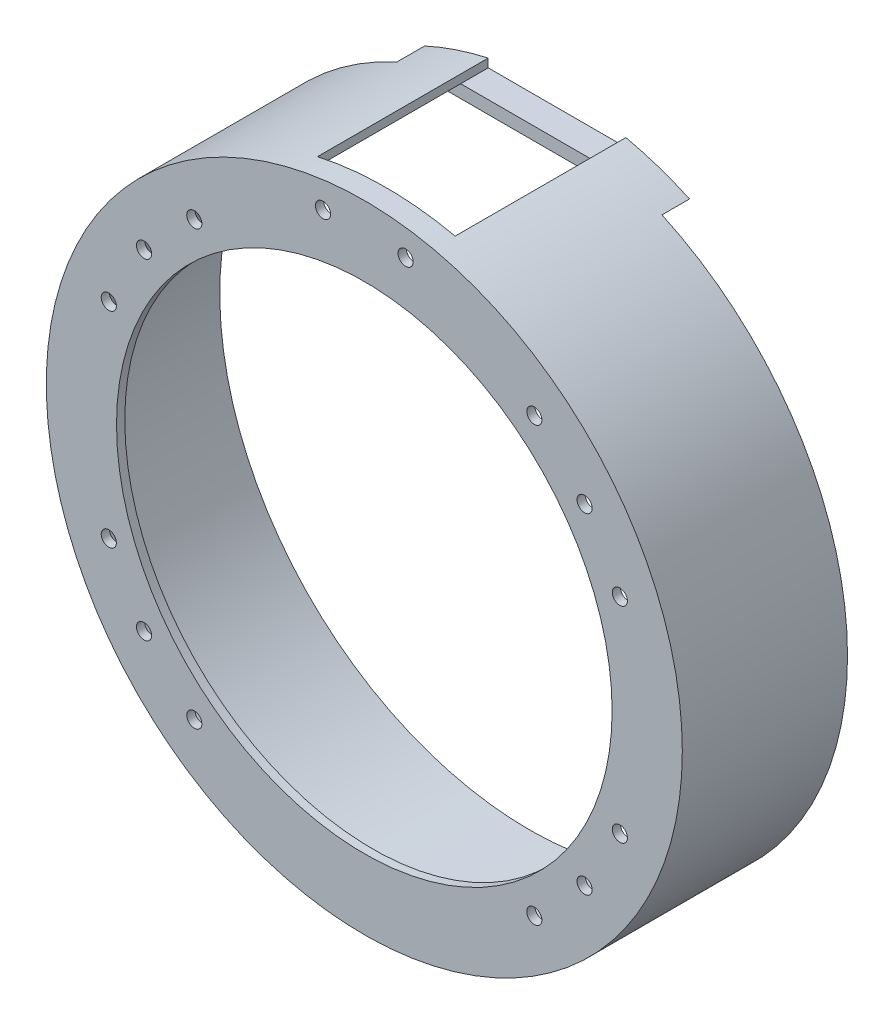
from build123d import *
from build123d.topology import SkipClean

# Parameters (mm, degrees)
SKETCH_1_R           = 112.5
SKETCH_1_R_2         = 90
EXTRUDE_1_DEPTH      = 3
EXTRUDE_START        = -60
EXTRUDE_2_DEPTH      = 60
SKETCH_5_R           = 2.75
CUT_EXTRUDE_1_DEPTH  = 10
EXTRUDE_3_DEPTH      = 5
EXTRUDE_3_DEPTH_BACK = 3
SKETCH_6_R           = 115.5
SKETCH_6_R_2         = 112.5
EXTRUDE_START_2      = 10
EXTRUDE_4_DEPTH      = 10


with BuildPart() as part:
    # 草图1 → 凸台-拉伸1 (new body)
    with BuildSketch(Plane.XY):
        Circle(SKETCH_1_R)
        Circle(SKETCH_1_R_2, mode=Mode.SUBTRACT)
    extrude(amount=EXTRUDE_1_DEPTH)

    # 草图4 → 凸台-拉伸2 (add)
    with BuildSketch(Plane.XY.offset(3).offset(EXTRUDE_START)):
        with BuildLine():
            Line((-25, 109.687054842), (-25, 112.76191733))
            ThreePointArc((-25, 112.76191733), (0, -115.5), (25, 112.76191733))
            Line((25, 112.76191733), (25, 109.687054842))
            ThreePointArc((25, 109.687054842), (0, -112.5), (-25, 109.687054842))
        make_face()
    extrude(amount=EXTRUDE_2_DEPTH)

    # 草图5 → 切除-拉伸1 (cut)
    with BuildSketch(Plane.XY.offset(3)):
        with Locations((80, 60)):
            Circle(SKETCH_5_R)
        with Locations((92.803208809, 37.250025969)):
            Circle(SKETCH_5_R)
        with Locations((61.744923397, 78.661073186)):
            Circle(SKETCH_5_R)
        with Locations((61.744923397, -78.661073186)):
            Circle(SKETCH_5_R)
        with Locations((92.803208809, -37.250025969)):
            Circle(SKETCH_5_R)
        with Locations((80, -60)):
            Circle(SKETCH_5_R)
        with Locations((-80, -60)):
            Circle(SKETCH_5_R)
        with Locations((-92.803208809, -37.250025969)):
            Circle(SKETCH_5_R)
        with Locations((-61.744923397, -78.661073186)):
            Circle(SKETCH_5_R)
        with Locations((-61.744923397, 78.661073186)):
            Circle(SKETCH_5_R)
        with Locations((-92.803208809, 37.250025969)):
            Circle(SKETCH_5_R)
        with Locations((-80, 60)):
            Circle(SKETCH_5_R)
        with Locations((15, 105)):
            Circle(SKETCH_5_R)
        with Locations((-15, 105)):
            Circle(SKETCH_5_R)
    extrude(amount=-CUT_EXTRUDE_1_DEPTH, mode=Mode.SUBTRACT)

    # 草图6 → 凸台-拉伸3 (add, two sides: drawn at the far end of the back side and taken through both)
    with SkipClean():  # the faces are left unmerged after this step: merging them gives an invalid solid
        with BuildSketch(Plane(origin=(0, 0, 0), x_dir=(-1, 0, 0), z_dir=(0, 0, -1)).offset(-EXTRUDE_3_DEPTH_BACK)):
            Circle(SKETCH_6_R)
            Circle(SKETCH_6_R_2, mode=Mode.SUBTRACT)
        extrude(amount=EXTRUDE_3_DEPTH + EXTRUDE_3_DEPTH_BACK)

    # 草图7 → 凸台-拉伸4 (add)
    with SkipClean():  # the faces are left unmerged after this step: merging them gives an invalid solid
        with BuildSketch(Plane(origin=(0, 0, -57), x_dir=(-1, 0, 0), z_dir=(0, 0, -1)).offset(EXTRUDE_START_2)):
            with BuildLine():
                Line((-48.117044797, 105), (48.117044797, 105))
                ThreePointArc((48.117044797, 105), (36.763941575, 109.492751358), (25, 112.76191733))
                Line((25, 112.76191733), (25, 109.687054842))
                Line((25, 109.687054842), (-25, 109.687054842))
                Line((-25, 109.687054842), (-25, 112.76191733))
                ThreePointArc((-25, 112.76191733), (-36.763941575, 109.492751358), (-48.117044797, 105))
            make_face()
        extrude(amount=-EXTRUDE_4_DEPTH)


solid = part.part
